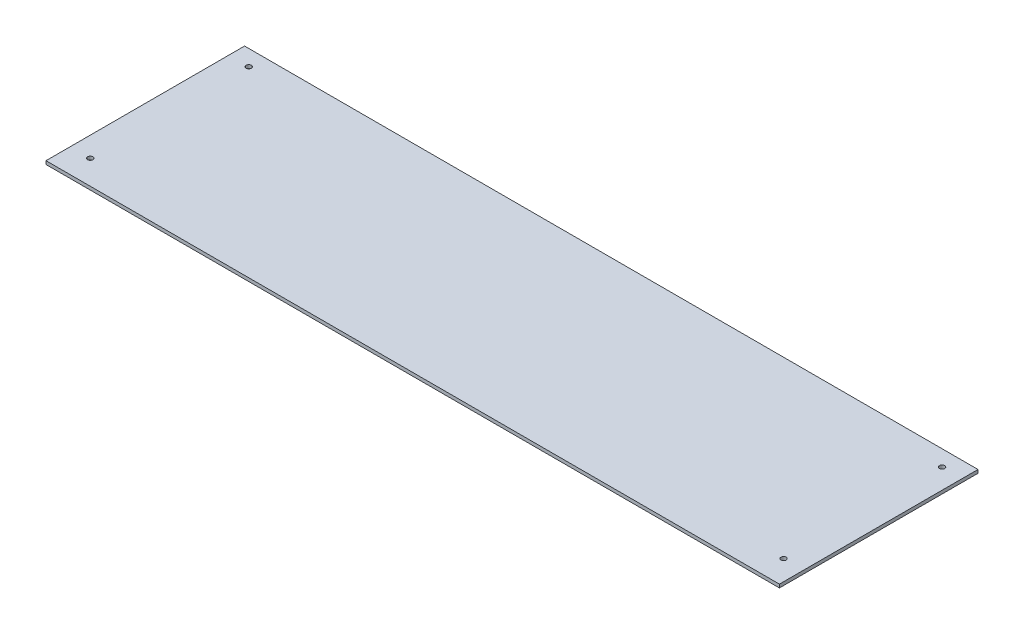
from build123d import *

# Parameters (mm, degrees)
CROQUIS1_W              = 440.5
CROQUIS1_H              = 120
CROQUIS1_R              = 1.55
SALIENTE_EXTRUIR1_DEPTH = 2
CROQUIS2_W              = 440.5
CROQUIS2_H              = 120
CROQUIS2_W_2            = 439.5
CROQUIS2_H_2            = 119
CORTAR_EXTRUIR1_DEPTH   = 2


with BuildPart() as part:
    # Croquis1 → Saliente-Extruir1 (new body)
    with BuildSketch(Plane(origin=(0, 0, 0), x_dir=(1, 0, 0), z_dir=(0, 1, 0))):
        with Locations((220.25, 60)):
            Rectangle(CROQUIS1_W, CROQUIS1_H)
        with Locations(Location((12.5, 15, 0), (0, 0, 270))):
            Circle(CROQUIS1_R, mode=Mode.SUBTRACT)
        with Locations(Location((12.5, 110, 0), (0, 0, 270))):
            Circle(CROQUIS1_R, mode=Mode.SUBTRACT)
        with Locations(Location((428, 15, 0), (0, 0, 90))):
            Circle(CROQUIS1_R, mode=Mode.SUBTRACT)
        with Locations(Location((428, 110, 0), (0, 0, 90))):
            Circle(CROQUIS1_R, mode=Mode.SUBTRACT)
    extrude(amount=SALIENTE_EXTRUIR1_DEPTH)

    # Croquis2 → Cortar-Extruir1 (cut)
    with BuildSketch(Plane.XZ):
        with Locations((220.25, -60)):
            Rectangle(CROQUIS2_W, CROQUIS2_H)
        with Locations((220.25, -60)):
            Rectangle(CROQUIS2_W_2, CROQUIS2_H_2, mode=Mode.SUBTRACT)
    extrude(amount=-CORTAR_EXTRUIR1_DEPTH, mode=Mode.SUBTRACT)


solid = part.part
